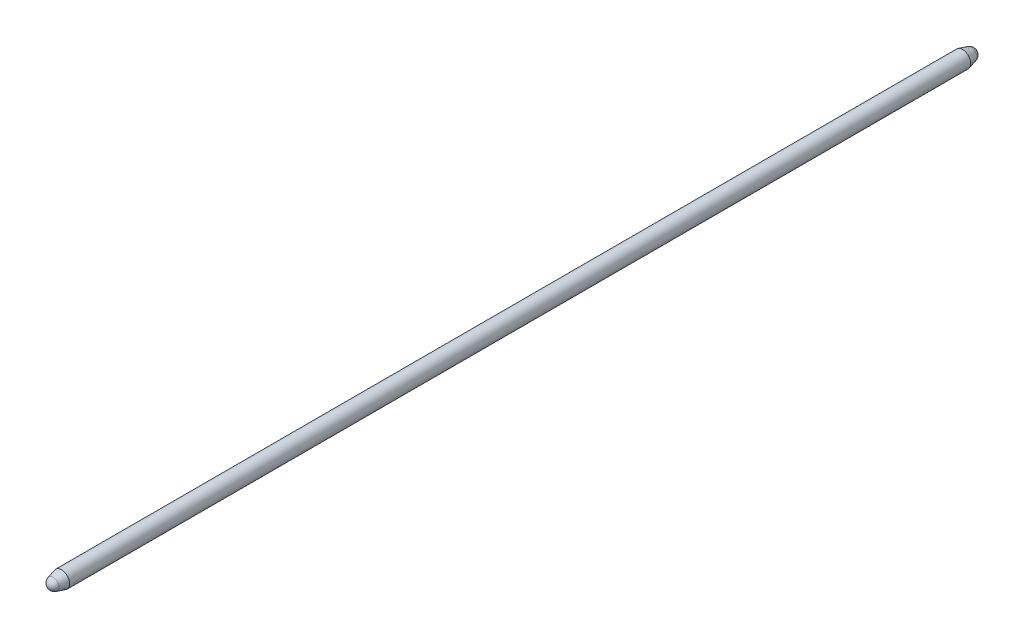
from build123d import *


with BuildPart() as part:
    # Sketch2 → Revolve1 (revolve)
    with BuildSketch(Plane(origin=(0, 0, 0), x_dir=(0, 0, -1), z_dir=(1, 0, 0))):
        with BuildLine():
            Line((1399.919484382, 25.4), (1426.04052974, 18.400886991))
            ThreePointArc((1426.04052974, 18.400886991), (1436.223408064, 11.596905223), (1440.160026931, 0))
            Line((1440.160026931, 0), (1399.919484382, 0))
            Line((1399.919484382, 0), (1399.919484382, 22.987))
            Line((1399.919484382, 22.987), (-1399.919484382, 22.987))
            Line((-1399.919484382, 22.987), (-1399.919484382, 0))
            Line((-1399.919484382, 0), (-1440.160026931, 0))
            ThreePointArc((-1440.160026931, 0), (-1436.223408064, 11.596905223), (-1426.04052974, 18.400886991))
            Line((-1426.04052974, 18.400886991), (-1399.919484382, 25.4))
            Line((-1399.919484382, 25.4), (1399.919484382, 25.4))
        make_face()
    revolve(axis=Axis((0, 0, -1440.160026931), (0, 0, 1)))


solid = part.part
